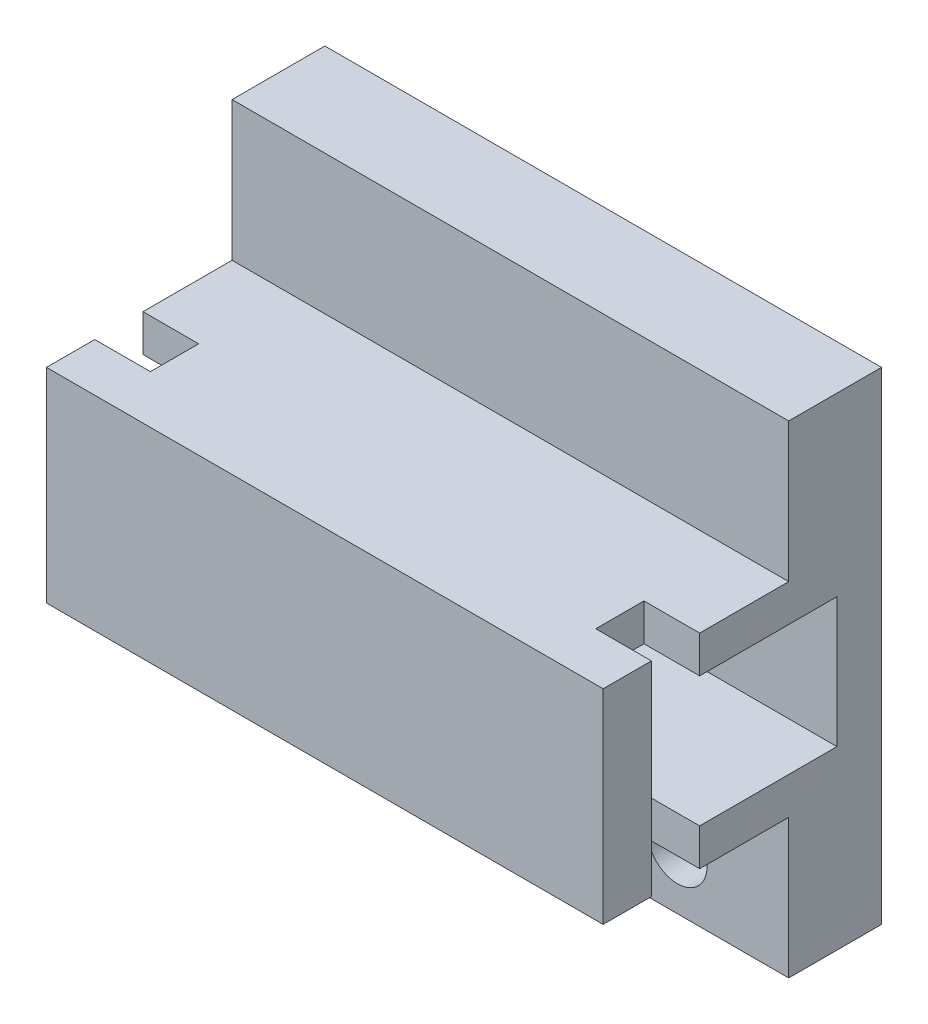
from build123d import *

# Parameters (mm, degrees)
SKETCH_1_W          = 150
SKETCH_1_H          = 130
EXTRUDE_1_DEPTH     = 25
SKETCH_2_W          = 150
SKETCH_2_H          = 55
EXTRUDE_2_DEPTH     = 50
SKETCH_4_R          = 8
CUT_EXTRUDE_2_DEPTH = 112.130553854
RIB_1_REACH         = 126.399
SKETCH_5_WALL_W     = 313.297106092
SKETCH_5_WALL_H     = 20
SKETCH_6_W          = 50
SKETCH_6_H          = 35
CUT_EXTRUDE_3_DEPTH = 180.861057486
SKETCH_8_W          = 13
SKETCH_8_H          = 55
CUT_EXTRUDE_4_DEPTH = 15


with BuildPart() as part:
    # Эскиз1 → Бобышка-Вытянуть1 (new body)
    with BuildSketch(Plane.XY):
        Rectangle(SKETCH_1_W, SKETCH_1_H)
    extrude(amount=EXTRUDE_1_DEPTH)

    # Эскиз2 → Бобышка-Вытянуть2 (add)
    with BuildSketch(Plane.XY.offset(25)):
        Rectangle(SKETCH_2_W, SKETCH_2_H)
    extrude(amount=EXTRUDE_2_DEPTH)

    # Эскиз4 → Вырез-Вытянуть2 (cut, through all)
    with BuildSketch(Plane.XY.offset(25)):
        with Locations((45, -50)):
            Circle(SKETCH_4_R)
    cut_extrude_2 = extrude(amount=-CUT_EXTRUDE_2_DEPTH, mode=Mode.SUBTRACT)

    # Эскиз5 wall → Ребро1 (add, up to next)
    with BuildSketch(Plane(origin=(0, -46.25, 50), x_dir=(0, -0.6, -0.8), z_dir=(0, 0.8, -0.6)), mode=Mode.PRIVATE) as rib_1_sk1:
        Rectangle(SKETCH_5_WALL_W, SKETCH_5_WALL_H)
    rib_1_tool1 = extrude(rib_1_sk1.sketch, amount=RIB_1_REACH, mode=Mode.PRIVATE) - part.part
    add(rib_1_tool1.solids().sort_by_distance((0, -46.25, 50))[0])

    # Зеркальное отражение1: Вырез-Вытянуть2 across plane
    add(cut_extrude_2.mirror(Plane(origin=(0, 0, 0), x_dir=(0, 0, 1), z_dir=(1, 0, 0))), mode=Mode.SUBTRACT)

    # Эскиз6 → Вырез-Вытянуть3 (cut, through all)
    with BuildSketch(Plane(origin=(75, 0, 0), x_dir=(0, 0, -1), z_dir=(1, 0, 0))):
        with Locations((-37, 0)):
            Rectangle(SKETCH_6_W, SKETCH_6_H)
    extrude(amount=-CUT_EXTRUDE_3_DEPTH, mode=Mode.SUBTRACT)

    # Эскиз8 → Вырез-Вытянуть4 (cut)
    with BuildSketch(Plane(origin=(75, 0, 0), x_dir=(0, 0, -1), z_dir=(1, 0, 0))):
        with Locations((-55.5, 0)):
            Rectangle(SKETCH_8_W, SKETCH_8_H)
    cut_extrude_4 = extrude(amount=-CUT_EXTRUDE_4_DEPTH, mode=Mode.SUBTRACT)

    # Зеркальное отражение2: Вырез-Вытянуть4 across plane
    add(cut_extrude_4.mirror(Plane(origin=(0, 0, 0), x_dir=(0, 0, 1), z_dir=(1, 0, 0))), mode=Mode.SUBTRACT)


solid = part.part
